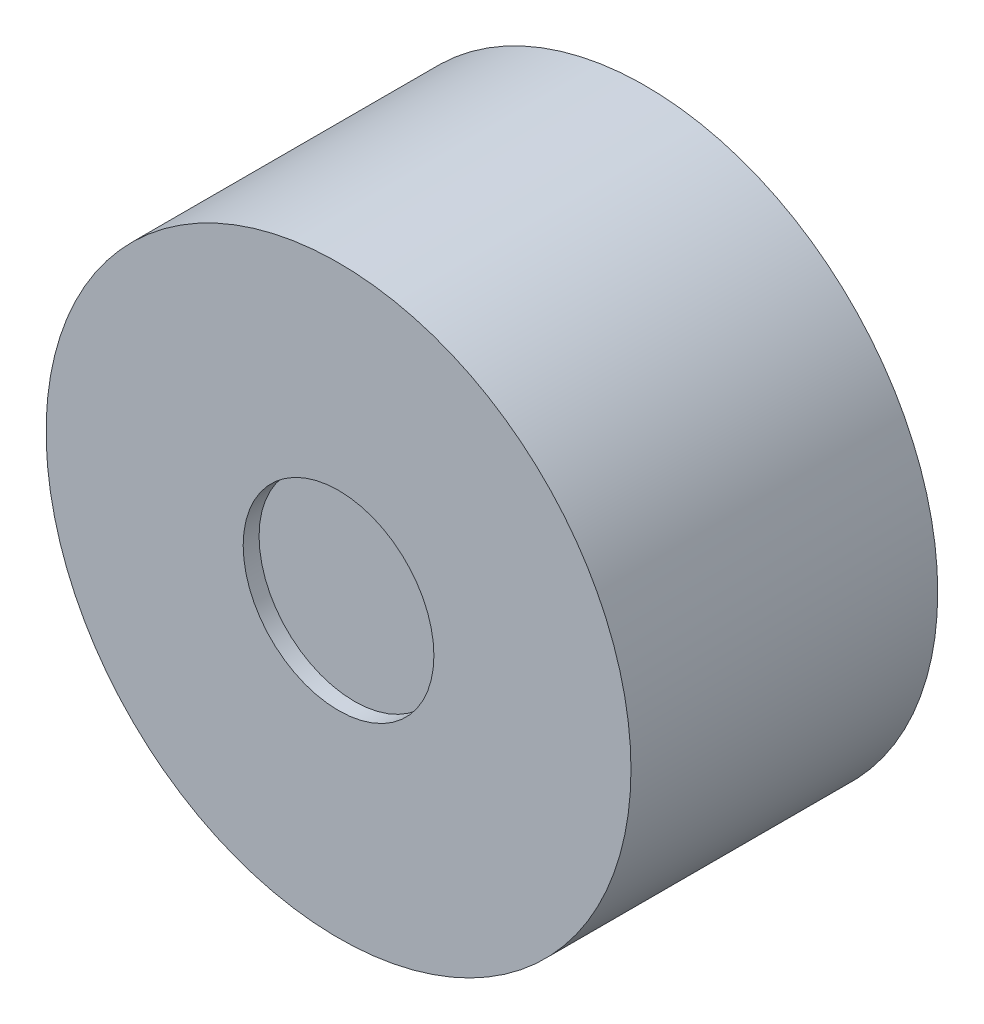
from build123d import *

# Parameters (mm, degrees)
CROQUIS1_R              = 18.4
SALIENTE_EXTRUIR1_DEPTH = 24.3
CROQUIS2_R              = 3
CROQUIS2_R_2            = 1.25
CORTAR_EXTRUIR1_DEPTH   = 5
CROQUIS3_R              = 1.25
CORTAR_EXTRUIR2_DEPTH   = 5
CORTAR_EXTRUIR3_START   = -5
CROQUIS6_R              = 18.4
CORTAR_EXTRUIR3_DEPTH   = 5
CROQUIS7_R              = 6
CORTAR_EXTRUIR4_DEPTH   = 1


with BuildPart() as part:
    # Croquis1 → Saliente-Extruir1 (new body)
    with BuildSketch(Plane.XY):
        Circle(CROQUIS1_R)
    extrude(amount=SALIENTE_EXTRUIR1_DEPTH)

    # Croquis2 → Cortar-Extruir1 (cut)
    with BuildSketch(Plane.XY.offset(24.3)):
        Circle(CROQUIS2_R)
        with Locations((0, 9.5)):
            Circle(CROQUIS2_R_2)
        with Locations((9.5, 0)):
            Circle(CROQUIS2_R_2)
        with Locations((0, -9.5)):
            Circle(CROQUIS2_R_2)
        with Locations((-9.5, 0)):
            Circle(CROQUIS2_R_2)
    extrude(amount=-CORTAR_EXTRUIR1_DEPTH, mode=Mode.SUBTRACT)

    # Croquis3 → Cortar-Extruir2 (cut)
    with BuildSketch(Plane(origin=(0, 0, 0), x_dir=(-1, 0, 0), z_dir=(0, 0, -1))):
        with Locations((-10, 0)):
            Circle(CROQUIS3_R)
        with Locations((0, 10)):
            Circle(CROQUIS3_R)
        with Locations((10, 0)):
            Circle(CROQUIS3_R)
        with Locations((0, -10)):
            Circle(CROQUIS3_R)
    extrude(amount=-CORTAR_EXTRUIR2_DEPTH, mode=Mode.SUBTRACT)

    # Croquis6 → Cortar-Extruir3 (cut)
    with BuildSketch(Plane.XY.offset(24.3).offset(CORTAR_EXTRUIR3_START)):
        Circle(CROQUIS6_R)
    extrude(amount=CORTAR_EXTRUIR3_DEPTH, mode=Mode.SUBTRACT)

    # Croquis7 → Cortar-Extruir4 (cut)
    with BuildSketch(Plane.XY.offset(19.3)):
        Circle(CROQUIS7_R)
    extrude(amount=-CORTAR_EXTRUIR4_DEPTH, mode=Mode.SUBTRACT)


solid = part.part
